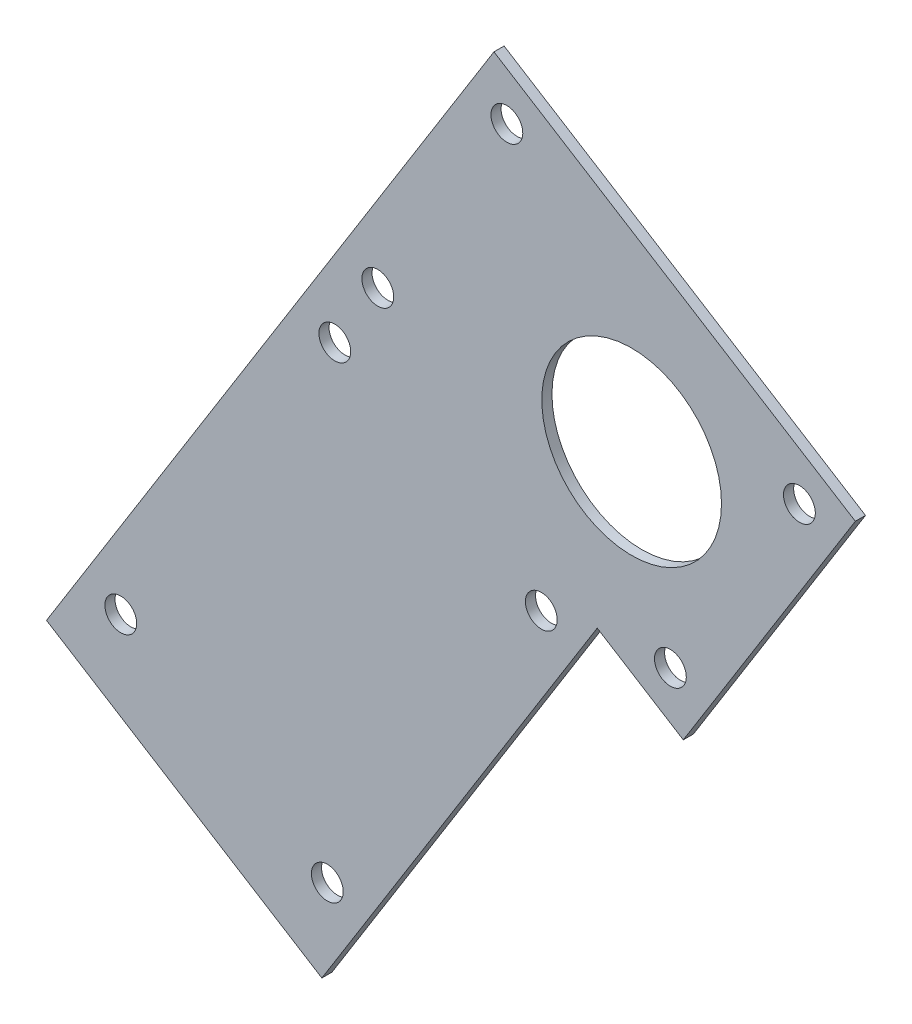
from build123d import *

# Parameters (mm, degrees)
BOSS_EXTRUDE1_DEPTH    = 1.5875
F_10_CLEARANCE_HOLE1_D = 4.9784
SKETCH5_R              = 14.057169334
CUT_EXTRUDE1_DEPTH     = 2.54
F_10_CLEARANCE_HOLE2_D = 4.9784


with BuildPart() as part:
    # Sketch2 → Boss-Extrude1 (new body)
    with BuildSketch(Plane(origin=(0, 0, 189.78999271), x_dir=(-1, 0, 0), z_dir=(0, 0, -1))):
        Polygon((57.864732818, -87.431436787), (84.784631441, -130.512280072), (98.247394968, -122.099811752), (141.333866252, -191.052579482), (184.414709536, -164.132680859), (114.40833963, -52.099069844), align=None)
    extrude(amount=BOSS_EXTRUDE1_DEPTH)

    # #10 Clearance Hole1 (through all)
    with Locations(Plane(origin=(0, 0, 188.20249271), x_dir=(-1, 0, 0), z_dir=(0, 0, -1))):
        with Locations((106.997487706, -124.119929835), (86.804749524, -121.762187333), (112.388221547, -60.849162582), (132.578145514, -93.159795046), (139.30812017, -103.930005867), (172.792086333, -157.515553088), (140.48145387, -177.705477055)):
            Hole(F_10_CLEARANCE_HOLE1_D / 2)

    # Sketch5 → Cut-Extrude1 (cut)
    with BuildSketch(Plane.XY.offset(189.78999271)):
        with Locations((-92.865103341, -95.511909387)):
            Circle(SKETCH5_R)
    extrude(amount=-CUT_EXTRUDE1_DEPTH, mode=Mode.SUBTRACT)

    # #10 Clearance Hole2 (through all)
    with Locations(Plane.XY.offset(189.78999271)):
        with Locations((-66.614825557, -89.451554869)):
            Hole(F_10_CLEARANCE_HOLE2_D / 2)


solid = part.part
